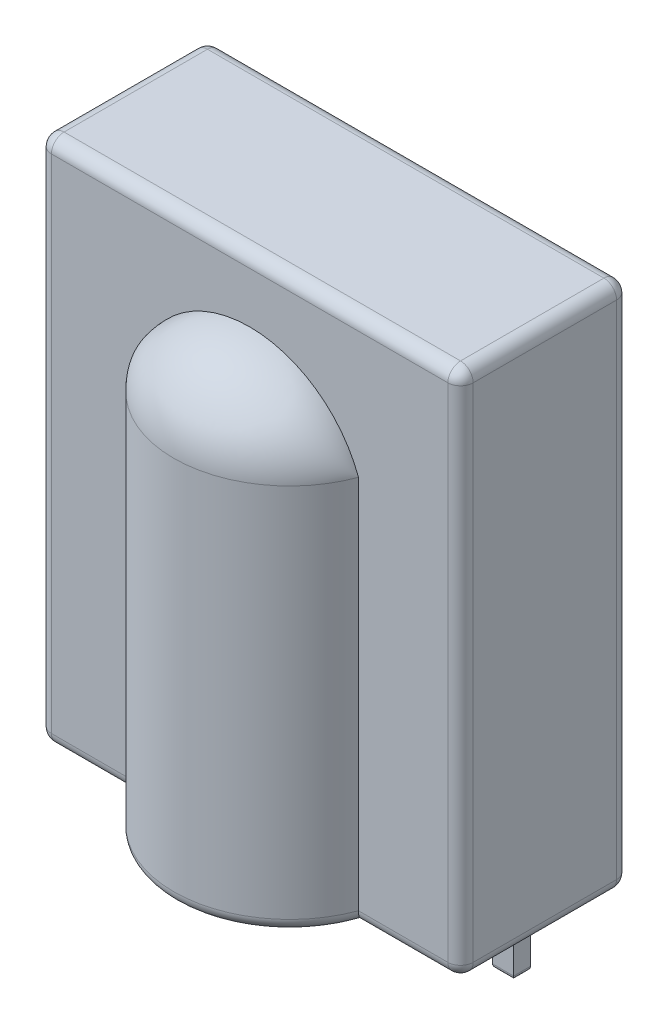
from build123d import *

# Parameters (mm, degrees)
SKETCH_1_W        = 0.5
SKETCH_1_H        = 0.4
EXTRUDE_1_DEPTH   = 0.5
EXTRUDE_1_2_DEPTH = 0.5
EXTRUDE_1_3_DEPTH = 0.5
SKETCH_3_W        = 10
SKETCH_3_H        = 4
EXTRUDE_2_DEPTH   = 12.5
EXTRUDE_3_DEPTH   = 9.2
REVOLVE_1_ANGLE   = 90
FILLET_1_R        = 0.3
SKETCH_1_2_W      = 0.5
SKETCH_1_2_H      = 0.4
EXTRUDE_4_DEPTH   = 1
EXTRUDE_4_2_DEPTH = 1
EXTRUDE_4_3_DEPTH = 1
FILLET_2_R        = 0.1
FILLET_3_R        = 0.1
FILLET_4_R        = 0.1


with BuildPart() as part:
    # Эскиз1 → Бобышка-Вытянуть1 (new body)
    with BuildSketch(Plane(origin=(0, 0, 0), x_dir=(1, 0, 0), z_dir=(0, 1, 0))):
        with Locations((-2.54, 0)):
            Rectangle(SKETCH_1_W, SKETCH_1_H)
    extrude(amount=EXTRUDE_1_DEPTH)



with BuildPart() as body_2:
    # Эскиз1 → Extrude 1 2 (new body)
    with BuildSketch(Plane(origin=(0, 0, 0), x_dir=(1, 0, 0), z_dir=(0, 1, 0))):
        Rectangle(SKETCH_1_W, SKETCH_1_H)
    extrude(amount=EXTRUDE_1_2_DEPTH)


with BuildPart() as body_3:
    # Эскиз1 → Extrude 1 3 (new body)
    with BuildSketch(Plane(origin=(0, 0, 0), x_dir=(1, 0, 0), z_dir=(0, 1, 0))):
        with Locations((5.08, 0)):
            Rectangle(SKETCH_1_W, SKETCH_1_H)
    extrude(amount=EXTRUDE_1_3_DEPTH)


with BuildPart() as part_1:
    add(part.part)

    add(body_2.part)  # Бобышка-Вытянуть2 merges body 2

    add(body_3.part)  # Бобышка-Вытянуть2 merges body 3
    # Эскиз3 → Бобышка-Вытянуть2 (add)
    with BuildSketch(Plane(origin=(0, 0.5, 0), x_dir=(1, 0, 0), z_dir=(0, 1, 0))):
        with Locations((1.27, -0.4)):
            Rectangle(SKETCH_3_W, SKETCH_3_H)
    extrude(amount=EXTRUDE_2_DEPTH)

    # Эскиз4 → Бобышка-Вытянуть3 (add)
    with BuildSketch(Plane.XZ.offset(-0.5)):
        with BuildLine():
            Line((6.27, 2.4), (3.85069758, 2.4))
            ThreePointArc((3.85069758, 2.4), (1.27, 4.2), (-1.31069758, 2.4))
            Line((-1.31069758, 2.4), (-3.73, 2.4))
            Line((-3.73, 2.4), (-3.73, -1.6))
            Line((-3.73, -1.6), (6.27, -1.6))
            Line((6.27, -1.6), (6.27, 2.4))
        make_face()
    extrude(amount=-EXTRUDE_3_DEPTH)

    # Эскиз7 → Повернуть1 (revolve)
    with BuildSketch(Plane(origin=(0, 9.7, 0), x_dir=(1, 0, 0), z_dir=(0, 1, 0))):
        with BuildLine():
            Line((-1.31069758, -2.4), (3.85069758, -2.4))
            ThreePointArc((3.85069758, -2.4), (1.27, -4.2), (-1.31069758, -2.4))
        make_face()
    revolve(axis=Axis((-1.31069758, 9.7, 2.4), (-1, 0, 0)), revolution_arc=REVOLVE_1_ANGLE)

    # Скругление1
    fillet_1_edges = [part_1.edges().sort_by_distance(p)[0] for p in [
        (5.08, 0.5, -0.2),
        (5.33, 0.5, 0),
        (5.08, 0.5, 0.2),
        (4.83, 0.5, 0),
        (-2.54, 0.5, -0.2),
        (-2.29, 0.5, 0),
        (-2.54, 0.5, 0.2),
        (-2.79, 0.5, 0),
        (1.27, 0.5, -1.6),
        (-2.52034879, 0.5, 2.4),
        (1.27, 0.5, 4.2),
        (5.06034879, 0.5, 2.4),
        (-0.25, 0.5, 0),
        (0, 0.5, -0.2),
        (0.25, 0.5, 0),
        (0, 0.5, 0.2),
        (-3.73, 6.75, 2.4),
        (-3.73, 0.5, 0.4),
        (-3.73, 6.75, -1.6),
        (6.27, 6.75, -1.6),
        (6.27, 0.5, 0.4),
        (6.27, 6.75, 2.4),
        (1.27, 13, 2.4),
        (-3.73, 13, 0.4),
        (1.27, 13, -1.6),
        (6.27, 13, 0.4),
    ]]
    fillet(fillet_1_edges, radius=FILLET_1_R)


with BuildPart() as body_2_2:
    # Эскиз1<2> → Бобышка-Вытянуть4 (new body)
    with BuildSketch(Plane(origin=(0, 0, 0), x_dir=(1, 0, 0), z_dir=(0, 1, 0))):
        with Locations((-2.54, 0)):
            Rectangle(SKETCH_1_2_W, SKETCH_1_2_H)
    extrude(amount=-EXTRUDE_4_DEPTH)

    # Скругление2
    fillet_2_edges = [body_2_2.edges().sort_by_distance(p)[0] for p in [
        (-2.29, -1, 0),
        (-2.54, -1, -0.2),
        (-2.79, -1, 0),
        (-2.54, -1, 0.2),
    ]]
    fillet(fillet_2_edges, radius=FILLET_2_R)


with BuildPart() as body_3_2:
    # Эскиз1<2> → Extrude 4 2 (new body)
    with BuildSketch(Plane(origin=(0, 0, 0), x_dir=(1, 0, 0), z_dir=(0, 1, 0))):
        Rectangle(SKETCH_1_2_W, SKETCH_1_2_H)
    extrude(amount=-EXTRUDE_4_2_DEPTH)

    # Скругление3
    fillet_3_edges = [body_3_2.edges().sort_by_distance(p)[0] for p in [
        (0, -1, -0.2),
        (-0.25, -1, 0),
        (0, -1, 0.2),
        (0.25, -1, 0),
    ]]
    fillet(fillet_3_edges, radius=FILLET_3_R)


with BuildPart() as body_4:
    # Эскиз1<2> → Extrude 4 3 (new body)
    with BuildSketch(Plane(origin=(0, 0, 0), x_dir=(1, 0, 0), z_dir=(0, 1, 0))):
        with Locations((5.08, 0)):
            Rectangle(SKETCH_1_2_W, SKETCH_1_2_H)
    extrude(amount=-EXTRUDE_4_3_DEPTH)

    # Скругление4
    fillet_4_edges = [body_4.edges().sort_by_distance(p)[0] for p in [
        (5.33, -1, 0),
        (5.08, -1, -0.2),
        (4.83, -1, 0),
        (5.08, -1, 0.2),
    ]]
    fillet(fillet_4_edges, radius=FILLET_4_R)


solid = Compound([part_1.part, body_2_2.part, body_3_2.part, body_4.part])
